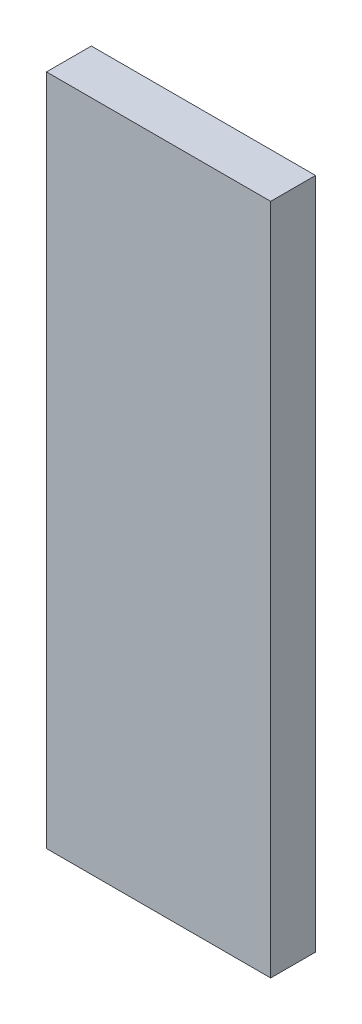
from build123d import *

# Parameters (mm, degrees)
CROQUIS1_W              = 5
CROQUIS1_H              = 15
SALIENTE_EXTRUIR1_DEPTH = 1


with BuildPart() as part:
    # Croquis1 → Saliente-Extruir1 (new body)
    with BuildSketch(Plane.XY):
        with Locations((-41.263983636, 17.815050794)):
            Rectangle(CROQUIS1_W, CROQUIS1_H)
    extrude(amount=SALIENTE_EXTRUIR1_DEPTH)


solid = part.part
